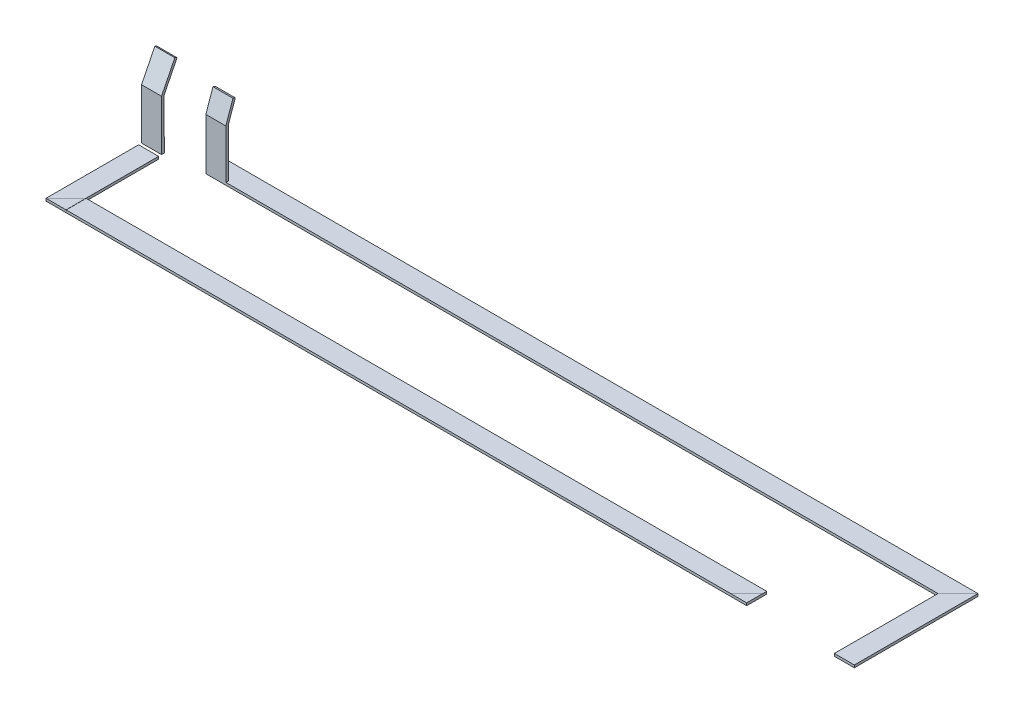
from build123d import *

# Parameters (mm, degrees)
CROQUIS2_W              = 50.8
CROQUIS2_H              = 6.31
CROQUIS3_W              = 50.8
CROQUIS3_H              = 6.31
CROQUIS4_W              = 60
CROQUIS4_H              = 53.155
SALIENTE_EXTRUIR1_DEPTH = 6.31
CROQUIS5_W              = 60
CROQUIS5_H              = 6.31
CORTAR_EXTRUIR1_DEPTH   = 6.31
CORTAR_EXTRUIR2_DEPTH   = 502
CROQUIS8_W              = 50.8
CROQUIS8_H              = 564.085
CORTAR_EXTRUIR3_DEPTH   = 502
CROQUIS9_W              = 314.3
CROQUIS9_H              = 1090.402933
CORTAR_EXTRUIR4_DEPTH   = 502
CROQUIS10_W             = 50.8
CROQUIS10_H             = 6.31
CORTAR_EXTRUIR5_DEPTH   = 95
CORTAR_EXTRUIR6_DEPTH   = 95
CROQUIS13_W             = 120
CROQUIS13_H             = 249.755
CORTAR_EXTRUIR7_DEPTH   = 95
CROQUIS16_W             = 125
CROQUIS16_H             = 50.8
SALIENTE_EXTRUIR4_DEPTH = 6.31
CROQUIS17_W             = 50.8
CROQUIS17_H             = 6.31
SALIENTE_EXTRUIR5_DEPTH = 50.8
SALIENTE_EXTRUIR6_DEPTH = 50.8
CROQUIS21_W             = 10
CROQUIS21_H             = 50.8
CORTAR_EXTRUIR9_DEPTH   = 53
CROQUIS22_W             = 0.5
CROQUIS22_H             = 50.8
CORTAR_EXTRUIR10_DEPTH  = 10


with BuildPart() as part:
    # Barrer1: sweep along a curve in space
    with BuildLine() as barrer1_path:
        Line((0, 0, 0), (0, -567.24, 0))
        Line((0, -567.24, 0), (0, -567.24, 316.2))
        Line((0, -567.24, 316.2), (1786.7, -567.24, 316.2))
        Line((1786.7, -567.24, 316.2), (1786.7, -567.24, 578))
        Line((1786.7, -567.24, 578), (1786.7, -435.47278313, 578))
        Line((1786.7, -435.47278313, 578), (1786.7, -435.47278313, 1432.002933))
    # Croquis2 → Barrer1 (sweep)
    with BuildSketch(Plane(origin=(0, 0, 0), x_dir=(1, 0, 0), z_dir=(0, 1, 0))):
        Rectangle(CROQUIS2_W, CROQUIS2_H)
        with Locations((263.5, 0)):
            Rectangle(CROQUIS2_W, CROQUIS2_H)
    sweep(path=barrer1_path.line, transition=Transition.RIGHT)

    # Barrer4: sweep along a curve in space
    with BuildLine() as barrer4_path:
        Line((-0.201028049, -3.155, -3.155), (-0.201028049, -3.155, -207.155))
        Line((-0.201028049, -3.155, -207.155), (-0.201028049, -53.155, -207.155))
    # Croquis3 → Barrer4 (sweep)
    with BuildSketch(Plane(origin=(0, 0, -3.155), x_dir=(-1, 0, 0), z_dir=(0, 0, -1))):
        with Locations((-263.5, -3.155)):
            Rectangle(CROQUIS3_W, CROQUIS3_H)
        with Locations((0, -3.155)):
            Rectangle(CROQUIS3_W, CROQUIS3_H)
    sweep(path=barrer4_path.line, transition=Transition.RIGHT)

    # Croquis4 → Saliente-Extruir1 (add)
    with BuildSketch(Plane(origin=(0, 0, -210.31), x_dir=(-1, 0, 0), z_dir=(0, 0, -1))):
        with Locations((-208.1, -26.5775)):
            Rectangle(CROQUIS4_W, CROQUIS4_H)
    extrude(amount=-SALIENTE_EXTRUIR1_DEPTH)

    # Croquis5 → Cortar-Extruir1 (cut)
    with BuildSketch(Plane.XY.offset(-204)):
        with Locations((208.1, -3.155)):
            Rectangle(CROQUIS5_W, CROQUIS5_H)
    extrude(amount=-CORTAR_EXTRUIR1_DEPTH, mode=Mode.SUBTRACT)

    # Croquis7 → Cortar-Extruir2 (cut)
    with BuildSketch(Plane.XY.offset(3.155)):
        Polygon((288.9, -564.085), (238.1, -564.085), (238.1, -68.875540851), (170.611072112, -68.875540851), (170.611072112, 0), (288.9, 0), align=None)
    extrude(amount=-CORTAR_EXTRUIR2_DEPTH, mode=Mode.SUBTRACT)

    # Croquis8 → Cortar-Extruir3 (cut)
    with BuildSketch(Plane.XY.offset(3.155)):
        with Locations((0, -282.0425)):
            Rectangle(CROQUIS8_W, CROQUIS8_H)
    extrude(amount=-CORTAR_EXTRUIR3_DEPTH, mode=Mode.SUBTRACT)

    # Croquis9 → Cortar-Extruir4 (cut)
    with BuildSketch(Plane(origin=(0, -432.31778313, 0), x_dir=(1, 0, 0), z_dir=(0, 1, 0))):
        with Locations((1918.45, -886.8014665)):
            Rectangle(CROQUIS9_W, CROQUIS9_H)
    extrude(amount=-CORTAR_EXTRUIR4_DEPTH, mode=Mode.SUBTRACT)

    # Croquis10 → Cortar-Extruir5 (cut)
    with BuildSketch(Plane(origin=(0, 0, -3.155), x_dir=(-1, 0, 0), z_dir=(0, 0, -1))):
        with Locations((0, -567.24)):
            Rectangle(CROQUIS10_W, CROQUIS10_H)
    extrude(amount=-CORTAR_EXTRUIR5_DEPTH, mode=Mode.SUBTRACT)

    # Croquis11 → Cortar-Extruir6 (cut)
    with BuildSketch(Plane(origin=(0, -564.085, 0), x_dir=(1, 0, 0), z_dir=(0, 1, 0))):
        Polygon((238.1, -78.1), (288.9, -78.1), (288.9, -27.3), align=None)
        Polygon((238.1, -78.1), (288.9, -27.3), (238.1, -27.3), align=None)
        Polygon((238.1, -27.3), (288.9, -27.3), (288.9, -3.155), (288.9, 3.155), (238.1, 3.155), (238.1, -3.155), align=None)
    extrude(amount=-CORTAR_EXTRUIR6_DEPTH, mode=Mode.SUBTRACT)

    # Croquis13 → Cortar-Extruir7 (cut)
    with BuildSketch(Plane(origin=(0, -564.085, 0), x_dir=(1, 0, 0), z_dir=(0, 1, 0))):
        with Locations((34.6, -216.7225)):
            Rectangle(CROQUIS13_W, CROQUIS13_H)
    extrude(amount=-CORTAR_EXTRUIR7_DEPTH, mode=Mode.SUBTRACT)

    # Croquis16 → Saliente-Extruir4 (add)
    with BuildSketch(Plane(origin=(0, -564.085, 0), x_dir=(1, 0, 0), z_dir=(0, 1, 0))):
        with Locations((226.4, -52.7)):
            Rectangle(CROQUIS16_W, CROQUIS16_H)
    extrude(amount=-SALIENTE_EXTRUIR4_DEPTH)

    # Barrer5: sweep along a curve in space
    with BuildLine() as barrer5_path:
        Line((94.6, -567.24, 316.2), (46.55, -567.24, 316.2))
        Line((46.55, -567.24, 316.2), (46.55, -567.24, 106.2))
    # Croquis17 → Barrer5 (sweep)
    with BuildSketch(Plane.ZY.offset(-94.6)):
        with Locations((316.2, -567.24)):
            Rectangle(CROQUIS17_W, CROQUIS17_H)
    sweep(path=barrer5_path.line, transition=Transition.RIGHT)

    # Croquis20 → Saliente-Extruir6 (add)
    with BuildSketch(Plane.ZY.offset(-163.9)):
        Polygon((78.1, -564.085), (78.1, -439.884522326), (59.966060883, -387.925515276), (54.008468178, -390.004743297), (71.79, -440.954001003), (71.79, -564.085), align=None)
    extrude(amount=-SALIENTE_EXTRUIR6_DEPTH)

    # Croquis21 → Cortar-Extruir9 (cut)
    with BuildSketch(Plane(origin=(0, -564.085, 0), x_dir=(1, 0, 0), z_dir=(0, 1, 0))):
        with Locations((1807.1, -316.2)):
            Rectangle(CROQUIS21_W, CROQUIS21_H)
    extrude(amount=-CORTAR_EXTRUIR9_DEPTH, mode=Mode.SUBTRACT)

    # Croquis22 → Cortar-Extruir10 (cut)
    with BuildSketch(Plane(origin=(0, -564.085, 0), x_dir=(1, 0, 0), z_dir=(0, 1, 0))):
        with Locations((72.2, -316.2)):
            Rectangle(CROQUIS22_W, CROQUIS22_H)
    extrude(amount=-CORTAR_EXTRUIR10_DEPTH, mode=Mode.SUBTRACT)


with BuildPart() as body_2:
    # Croquis18 → Saliente-Extruir5 (new body)
    with BuildSketch(Plane.ZY.offset(-21.15)):
        Polygon((98.787204793, -564.085), (98.787204793, -435.522965931), (64.969988324, -367.622744457), (59.321737777, -370.435814978), (91.897545374, -435.843461779), (91.842933, -564.085), align=None)
    extrude(amount=-SALIENTE_EXTRUIR5_DEPTH)


solid = Compound([part.part, body_2.part])
